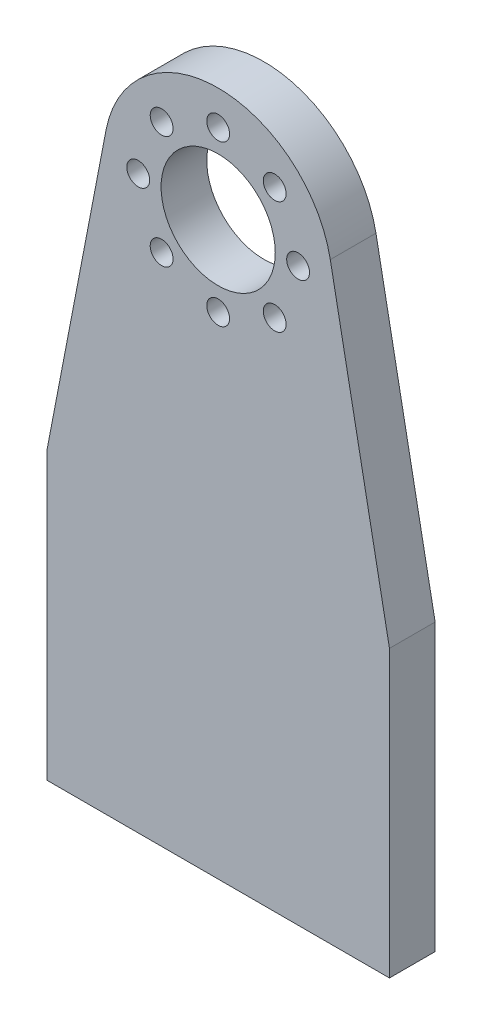
from build123d import *

# Parameters (mm, degrees)
SKETCH1_R           = 1
SKETCH1_R_2         = 5
BOSS_EXTRUDE1_DEPTH = 4


with BuildPart() as part:
    # Sketch1 → Boss-Extrude1 (new body)
    with BuildSketch(Plane.XY):
        with BuildLine():
            Line((-15, -7.896321871), (-9.819449375, 18.995347754))
            ThreePointArc((-9.819449375, 18.995347754), (0, 27.103678129), (9.819449375, 18.995347754))
            Line((9.819449375, 18.995347754), (15, -7.896321871))
            Line((15, -7.896321871), (15, -32.896321871))
            Line((15, -32.896321871), (-15, -32.896321871))
            Line((-15, -32.896321871), (-15, -7.896321871))
        make_face()
        with Locations((0, 24.103678129)):
            Circle(SKETCH1_R, mode=Mode.SUBTRACT)
        with Locations((4.949747468, 22.053425597)):
            Circle(SKETCH1_R, mode=Mode.SUBTRACT)
        with Locations((7, 17.103678129)):
            Circle(SKETCH1_R, mode=Mode.SUBTRACT)
        with Locations((4.949747468, 12.153930661)):
            Circle(SKETCH1_R, mode=Mode.SUBTRACT)
        with Locations((0, 10.103678129)):
            Circle(SKETCH1_R, mode=Mode.SUBTRACT)
        with Locations((-4.949747468, 12.153930661)):
            Circle(SKETCH1_R, mode=Mode.SUBTRACT)
        with Locations((-7, 17.103678129)):
            Circle(SKETCH1_R, mode=Mode.SUBTRACT)
        with Locations((-4.949747468, 22.053425597)):
            Circle(SKETCH1_R, mode=Mode.SUBTRACT)
        with Locations((0, 17.103678129)):
            Circle(SKETCH1_R_2, mode=Mode.SUBTRACT)
    extrude(amount=BOSS_EXTRUDE1_DEPTH)


solid = part.part
